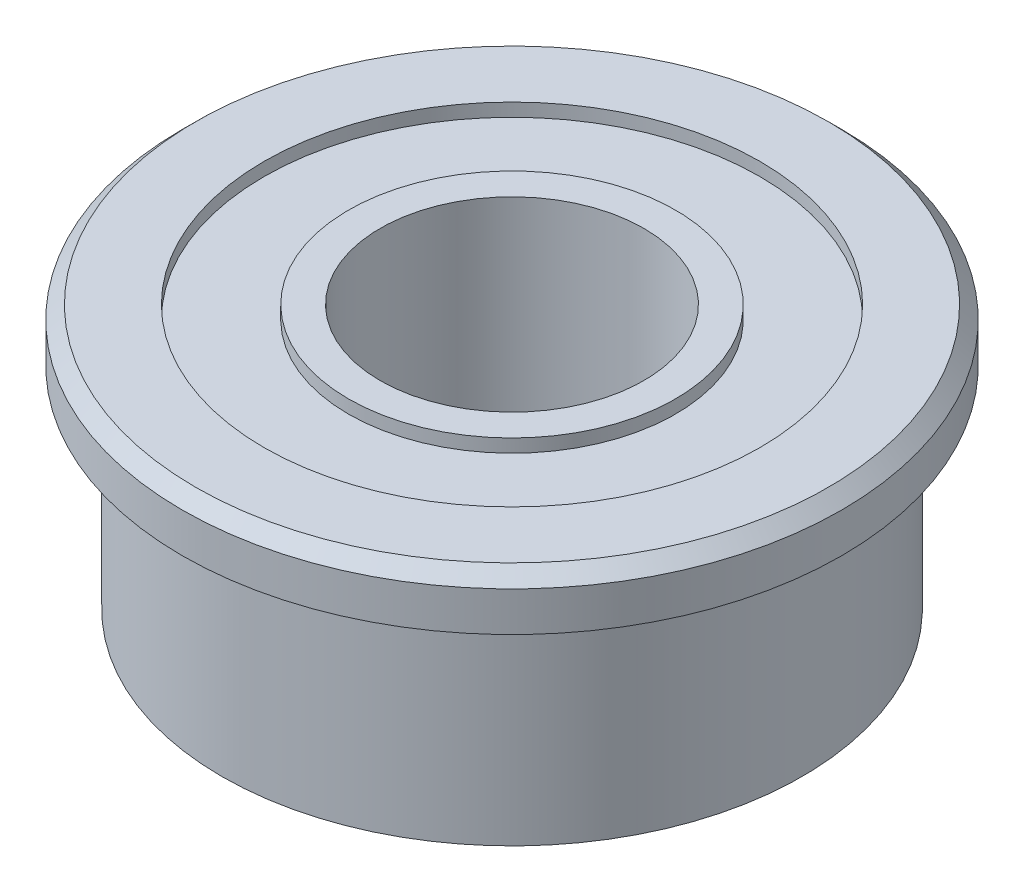
from build123d import *

# Parameters (mm, degrees)
SKETCH1_R           = 5.5
SKETCH1_R_2         = 2.5
BOSS_EXTRUDE1_DEPTH = 4
SKETCH2_R           = 6.25
SKETCH2_R_2         = 2.5
BOSS_EXTRUDE2_DEPTH = 1
SKETCH3_R           = 4.7
SKETCH3_R_2         = 3.1
CUT_EXTRUDE1_DEPTH  = 0.25
CUT_EXTRUDE2_START  = -0.25
SKETCH4_R           = 4.7
SKETCH4_R_2         = 3.1
CUT_EXTRUDE2_DEPTH  = 0.25
CHAMFER1_SIZE       = 0.25


with BuildPart() as part:
    # Sketch1 → Boss-Extrude1 (new body)
    with BuildSketch(Plane(origin=(0, 0, 0), x_dir=(1, 0, 0), z_dir=(0, 1, 0))):
        Circle(SKETCH1_R)
        Circle(SKETCH1_R_2, mode=Mode.SUBTRACT)
    extrude(amount=BOSS_EXTRUDE1_DEPTH)

    # Sketch2 → Boss-Extrude2 (add)
    with BuildSketch(Plane(origin=(0, 4, 0), x_dir=(1, 0, 0), z_dir=(0, 1, 0))):
        Circle(SKETCH2_R)
        Circle(SKETCH2_R_2, mode=Mode.SUBTRACT)
    extrude(amount=BOSS_EXTRUDE2_DEPTH)

    # Sketch3 → Cut-Extrude1 (cut)
    with BuildSketch(Plane.XZ):
        Circle(SKETCH3_R)
        Circle(SKETCH3_R_2, mode=Mode.SUBTRACT)
    extrude(amount=-CUT_EXTRUDE1_DEPTH, mode=Mode.SUBTRACT)

    # Sketch4 → Cut-Extrude2 (cut)
    with BuildSketch(Plane(origin=(0, 5, 0), x_dir=(1, 0, 0), z_dir=(0, 1, 0)).offset(CUT_EXTRUDE2_START)):
        Circle(SKETCH4_R)
        Circle(SKETCH4_R_2, mode=Mode.SUBTRACT)
    extrude(amount=CUT_EXTRUDE2_DEPTH, mode=Mode.SUBTRACT)

    # Chamfer1
    chamfer1_edges = [part.edges().sort_by_distance(p)[0] for p in [
        (-6.25, 5, 0),
    ]]
    chamfer(chamfer1_edges, length=CHAMFER1_SIZE)


solid = part.part
